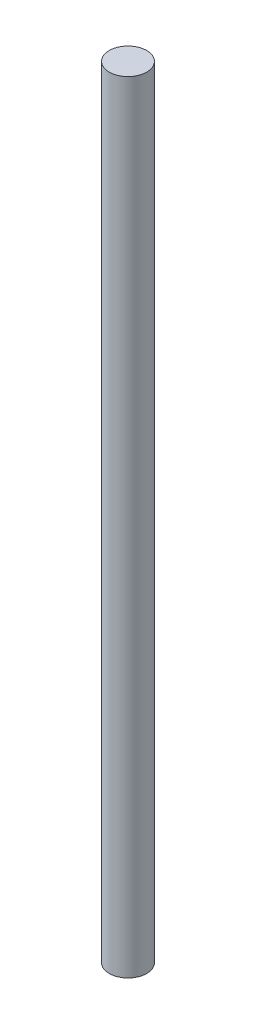
from build123d import *

# Parameters (mm, degrees)
SKETCH2_R           = 237.5
BOSS_EXTRUDE1_DEPTH = 9900


with BuildPart() as part:
    # Sketch2 → Boss-Extrude1 (new body)
    with BuildSketch(Plane(origin=(0, 0, 0), x_dir=(1, 0, 0), z_dir=(0, 1, 0))):
        with Locations(Location((0, 0, 0), (0, 0, 270))):
            Circle(SKETCH2_R)
    extrude(amount=BOSS_EXTRUDE1_DEPTH)


solid = part.part
